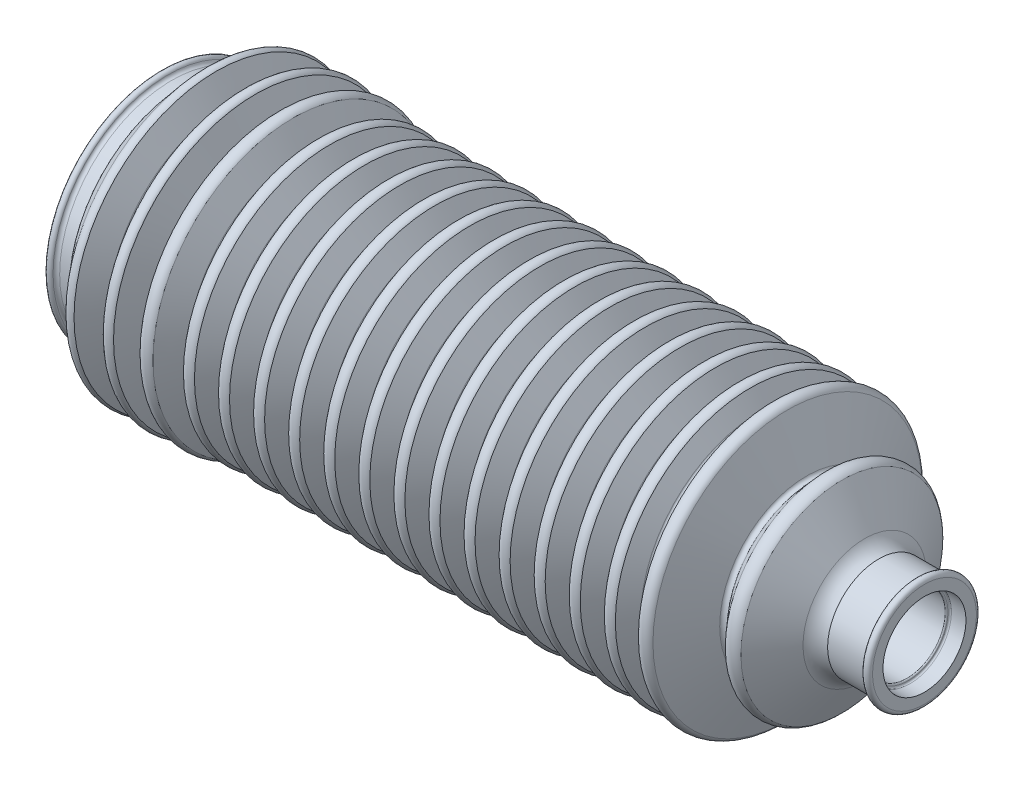
from build123d import *


with BuildPart() as part:
    # Çizim1 → Döndür1 (revolve)
    with BuildSketch(Plane.XY, mode=Mode.PRIVATE) as d_nd_r1_sk:
        with BuildLine():
            Line((2.442042698, 25.682705878), (5.35978701, 25.682705878))
            ThreePointArc((5.35978701, 25.682705878), (5.61428635, 25.959721917), (5.696851875, 26.32672428))
            ThreePointArc((5.696851875, 26.32672428), (5.767347383, 26.675489454), (5.996909977, 26.947349305))
            Line((5.996909977, 26.947349305), (10.710252465, 32.522734019))
            ThreePointArc((10.710252465, 32.522734019), (11.657912776, 32.930184403), (12.624912957, 32.571037453))
            Line((12.624912957, 32.571037453), (15.398221775, 27.429561456))
            ThreePointArc((15.398221775, 27.429561456), (16.049634164, 26.938765293), (16.73244835, 27.384841251))
            Line((16.73244835, 27.384841251), (19.206132076, 32.441141892))
            ThreePointArc((19.206132076, 32.441141892), (20.376636823, 33.053893473), (21.559377863, 32.465107017))
            Line((21.559377863, 32.465107017), (23.85452719, 27.056085174))
            ThreePointArc((23.85452719, 27.056085174), (24.292703712, 26.619455169), (24.811438207, 26.956440258))
            Line((24.811438207, 26.956440258), (27.308879439, 32.14423882))
            ThreePointArc((27.308879439, 32.14423882), (28.766548923, 32.766887292), (30.189293521, 32.068110321))
            Line((30.189293521, 32.068110321), (32.918133018, 26.850423285))
            ThreePointArc((32.918133018, 26.850423285), (33.296230534, 26.56762954), (33.711643836, 26.792043936))
            Line((33.711643836, 26.792043936), (35.858345326, 30.708160913))
            ThreePointArc((35.858345326, 30.708160913), (37.15712317, 31.493093553), (38.577391933, 30.958509809))
            Line((38.577391933, 30.958509809), (40.947829736, 26.850423285))
            ThreePointArc((40.947829736, 26.850423285), (41.325927251, 26.56762954), (41.741340554, 26.792043936))
            Line((41.741340554, 26.792043936), (43.888042043, 30.708160913))
            ThreePointArc((43.888042043, 30.708160913), (45.186819888, 31.493093553), (46.607088651, 30.958509809))
            Line((46.607088651, 30.958509809), (48.977526453, 26.850423285))
            ThreePointArc((48.977526453, 26.850423285), (49.355623969, 26.56762954), (49.771037271, 26.792043936))
            Line((49.771037271, 26.792043936), (51.917738761, 30.708160913))
            ThreePointArc((51.917738761, 30.708160913), (53.216516605, 31.493093553), (54.636785368, 30.958509809))
            Line((54.636785368, 30.958509809), (57.007223171, 26.850423285))
            ThreePointArc((57.007223171, 26.850423285), (57.385320686, 26.56762954), (57.800733989, 26.792043936))
            Line((57.800733989, 26.792043936), (59.947435478, 30.708160913))
            ThreePointArc((59.947435478, 30.708160913), (61.246213323, 31.493093553), (62.666482086, 30.958509809))
            Line((62.666482086, 30.958509809), (65.036919888, 26.850423285))
            ThreePointArc((65.036919888, 26.850423285), (65.415017404, 26.56762954), (65.830430706, 26.792043936))
            Line((65.830430706, 26.792043936), (67.977132196, 30.708160913))
            ThreePointArc((67.977132196, 30.708160913), (69.27591004, 31.493093553), (70.696178804, 30.958509809))
            Line((70.696178804, 30.958509809), (73.066616606, 26.850423285))
            ThreePointArc((73.066616606, 26.850423285), (73.444714121, 26.56762954), (73.860127424, 26.792043936))
            Line((73.860127424, 26.792043936), (76.006828913, 30.708160913))
            ThreePointArc((76.006828913, 30.708160913), (77.305606758, 31.493093553), (78.725875521, 30.958509809))
            Line((78.725875521, 30.958509809), (81.096313324, 26.850423285))
            ThreePointArc((81.096313324, 26.850423285), (81.474410839, 26.56762954), (81.889824141, 26.792043936))
            Line((81.889824141, 26.792043936), (84.036525631, 30.708160913))
            ThreePointArc((84.036525631, 30.708160913), (85.335303476, 31.493093553), (86.755572239, 30.958509809))
            Line((86.755572239, 30.958509809), (89.126010041, 26.850423285))
            ThreePointArc((89.126010041, 26.850423285), (89.504107557, 26.56762954), (89.919520859, 26.792043936))
            Line((89.919520859, 26.792043936), (92.066222349, 30.708160913))
            ThreePointArc((92.066222349, 30.708160913), (93.365000193, 31.493093553), (94.785268956, 30.958509809))
            Line((94.785268956, 30.958509809), (97.155706759, 26.850423285))
            ThreePointArc((97.155706759, 26.850423285), (97.533804274, 26.56762954), (97.949217576, 26.792043936))
            Line((97.949217576, 26.792043936), (100.095919066, 30.708160913))
            ThreePointArc((100.095919066, 30.708160913), (101.394696911, 31.493093553), (102.814965674, 30.958509809))
            Line((102.814965674, 30.958509809), (105.185403476, 26.850423285))
            ThreePointArc((105.185403476, 26.850423285), (105.563500992, 26.56762954), (105.978914294, 26.792043936))
            Line((105.978914294, 26.792043936), (108.125615784, 30.708160913))
            ThreePointArc((108.125615784, 30.708160913), (109.424393628, 31.493093553), (110.844662391, 30.958509809))
            Line((110.844662391, 30.958509809), (113.215100194, 26.850423285))
            ThreePointArc((113.215100194, 26.850423285), (113.593197709, 26.56762954), (114.008611012, 26.792043936))
            Line((114.008611012, 26.792043936), (116.155312501, 30.708160913))
            ThreePointArc((116.155312501, 30.708160913), (117.454090346, 31.493093553), (118.874359109, 30.958509809))
            Line((118.874359109, 30.958509809), (121.244796911, 26.850423285))
            ThreePointArc((121.244796911, 26.850423285), (121.622894427, 26.56762954), (122.038307729, 26.792043936))
            Line((122.038307729, 26.792043936), (124.185009219, 30.708160913))
            ThreePointArc((124.185009219, 30.708160913), (125.483787063, 31.493093553), (126.904055826, 30.958509809))
            Line((126.904055826, 30.958509809), (129.274493629, 26.850423285))
            ThreePointArc((129.274493629, 26.850423285), (129.652591144, 26.56762954), (130.068004447, 26.792043936))
            Line((130.068004447, 26.792043936), (132.214705936, 30.708160913))
            ThreePointArc((132.214705936, 30.708160913), (133.513483781, 31.493093553), (134.933752544, 30.958509809))
            Line((134.933752544, 30.958509809), (137.003102678, 27.231199731))
            ThreePointArc((137.003102678, 27.231199731), (137.522353031, 26.792745686), (138.095027457, 27.158678577))
            Line((138.095027457, 27.158678577), (140.4474933, 31.198150005))
            ThreePointArc((140.4474933, 31.198150005), (142.019308645, 31.747561139), (143.38797466, 30.799294608))
            Line((143.38797466, 30.799294608), (147.756696056, 19.89130372))
            ThreePointArc((147.756696056, 19.89130372), (148.478492271, 19.325581266), (149.293260388, 19.746514261))
            Line((149.293260388, 19.746514261), (152.570897164, 23.422760657))
            ThreePointArc((152.570897164, 23.422760657), (154.265532643, 23.899676013), (155.838603554, 23.109305484))
            Line((155.838603554, 23.109305484), (161.056752801, 14.122530471))
            ThreePointArc((161.056752801, 14.122530471), (162.409693933, 12.580908141), (164.252673676, 11.680644413))
            Line((164.252673676, 11.680644413), (172.770427911, 11.680644413))
            Line((172.770427911, 11.680644413), (173.175299598, 12.522344697))
            ThreePointArc((173.175299598, 12.522344697), (174.179585106, 12.744035966), (174.745412136, 11.885213415))
            Line((174.745412136, 11.885213415), (174.745412136, 9.495471636))
            Line((174.745412136, 9.495471636), (171.412261756, 9.495471636))
            ThreePointArc((171.412261756, 9.495471636), (171.134575872, 9.371222686), (171.03118499, 9.085115053))
            ThreePointArc((171.03118499, 9.085115053), (170.966821966, 8.846989429), (170.756640389, 8.717876624))
            Line((170.756640389, 8.717876624), (159.049586299, 8.717876624))
            ThreePointArc((159.049586299, 8.717876624), (158.40246844, 9.152762072), (158.366028349, 9.931581047))
            ThreePointArc((158.366028349, 9.931581047), (158.546163717, 10.518617261), (158.388132242, 11.111985882))
            Line((158.388132242, 11.111985882), (154.571799231, 20.966099368))
            ThreePointArc((154.571799231, 20.966099368), (153.983181793, 21.527538085), (153.205199925, 21.289992019))
            Line((153.205199925, 21.289992019), (150.837273255, 17.982691094))
            ThreePointArc((150.837273255, 17.982691094), (148.927617218, 16.948031449), (146.911647806, 17.756223312))
            Line((146.911647806, 17.756223312), (142.052871885, 28.853643127))
            ThreePointArc((142.052871885, 28.853643127), (141.595087994, 29.186041394), (141.130385982, 28.863385634))
            Line((141.130385982, 28.863385634), (139.458570702, 25.533688839))
            ThreePointArc((139.458570702, 25.533688839), (137.828021595, 24.471056274), (136.045067616, 25.251410981))
            Line((136.045067616, 25.251410981), (134.225962455, 29.183148344))
            ThreePointArc((134.225962455, 29.183148344), (133.718464326, 29.490471744), (133.239957896, 29.139710259))
            Line((133.239957896, 29.139710259), (131.138044211, 25.193455164))
            ThreePointArc((131.138044211, 25.193455164), (129.706550589, 24.471056274), (128.238236354, 25.115329085))
            Line((128.238236354, 25.115329085), (126.196265738, 29.183148344))
            ThreePointArc((126.196265738, 29.183148344), (125.688767609, 29.490471744), (125.210261179, 29.139710259))
            Line((125.210261179, 29.139710259), (123.108347493, 25.193455164))
            ThreePointArc((123.108347493, 25.193455164), (121.676853871, 24.471056274), (120.208539636, 25.115329085))
            Line((120.208539636, 25.115329085), (118.16656902, 29.183148344))
            ThreePointArc((118.16656902, 29.183148344), (117.659070891, 29.490471744), (117.180564461, 29.139710259))
            Line((117.180564461, 29.139710259), (115.078650775, 25.193455164))
            ThreePointArc((115.078650775, 25.193455164), (113.647157153, 24.471056274), (112.178842919, 25.115329085))
            Line((112.178842919, 25.115329085), (110.136872303, 29.183148344))
            ThreePointArc((110.136872303, 29.183148344), (109.629374174, 29.490471744), (109.150867744, 29.139710259))
            Line((109.150867744, 29.139710259), (107.048954058, 25.193455164))
            ThreePointArc((107.048954058, 25.193455164), (105.617460436, 24.471056274), (104.149146201, 25.115329085))
            Line((104.149146201, 25.115329085), (102.107175585, 29.183148344))
            ThreePointArc((102.107175585, 29.183148344), (101.599677456, 29.490471744), (101.121171026, 29.139710259))
            Line((101.121171026, 29.139710259), (99.01925734, 25.193455164))
            ThreePointArc((99.01925734, 25.193455164), (97.587763718, 24.471056274), (96.119449484, 25.115329085))
            Line((96.119449484, 25.115329085), (94.077478868, 29.183148344))
            ThreePointArc((94.077478868, 29.183148344), (93.569980739, 29.490471744), (93.091474308, 29.139710259))
            Line((93.091474308, 29.139710259), (90.989560623, 25.193455164))
            ThreePointArc((90.989560623, 25.193455164), (89.558067001, 24.471056274), (88.089752766, 25.115329085))
            Line((88.089752766, 25.115329085), (86.04778215, 29.183148344))
            ThreePointArc((86.04778215, 29.183148344), (85.540284021, 29.490471744), (85.061777591, 29.139710259))
            Line((85.061777591, 29.139710259), (82.959863905, 25.193455164))
            ThreePointArc((82.959863905, 25.193455164), (81.528370283, 24.471056274), (80.060056049, 25.115329085))
            Line((80.060056049, 25.115329085), (78.018085432, 29.183148344))
            ThreePointArc((78.018085432, 29.183148344), (77.510587303, 29.490471744), (77.032080873, 29.139710259))
            Line((77.032080873, 29.139710259), (74.930167188, 25.193455164))
            ThreePointArc((74.930167188, 25.193455164), (73.498673566, 24.471056274), (72.030359331, 25.115329085))
            Line((72.030359331, 25.115329085), (69.988388715, 29.183148344))
            ThreePointArc((69.988388715, 29.183148344), (69.480890586, 29.490471744), (69.002384156, 29.139710259))
            Line((69.002384156, 29.139710259), (66.90047047, 25.193455164))
            ThreePointArc((66.90047047, 25.193455164), (65.468976848, 24.471056274), (64.000662613, 25.115329085))
            Line((64.000662613, 25.115329085), (61.958691997, 29.183148344))
            ThreePointArc((61.958691997, 29.183148344), (61.451193868, 29.490471744), (60.972687438, 29.139710259))
            Line((60.972687438, 29.139710259), (58.870773752, 25.193455164))
            ThreePointArc((58.870773752, 25.193455164), (57.439280131, 24.471056274), (55.970965896, 25.115329085))
            Line((55.970965896, 25.115329085), (53.92899528, 29.183148344))
            ThreePointArc((53.92899528, 29.183148344), (53.421497151, 29.490471744), (52.942990721, 29.139710259))
            Line((52.942990721, 29.139710259), (50.841077035, 25.193455164))
            ThreePointArc((50.841077035, 25.193455164), (49.409583413, 24.471056274), (47.941269178, 25.115329085))
            Line((47.941269178, 25.115329085), (45.899298562, 29.183148344))
            ThreePointArc((45.899298562, 29.183148344), (45.391800433, 29.490471744), (44.913294003, 29.139710259))
            Line((44.913294003, 29.139710259), (42.811380317, 25.193455164))
            ThreePointArc((42.811380317, 25.193455164), (41.379886695, 24.471056274), (39.911572461, 25.115329085))
            Line((39.911572461, 25.115329085), (37.869601845, 29.183148344))
            ThreePointArc((37.869601845, 29.183148344), (37.362103716, 29.490471744), (36.883597286, 29.139710259))
            Line((36.883597286, 29.139710259), (34.7816836, 25.193455164))
            ThreePointArc((34.7816836, 25.193455164), (33.350189978, 24.471056274), (31.881875743, 25.115329085))
            Line((31.881875743, 25.115329085), (29.232591279, 30.44177292))
            ThreePointArc((29.232591279, 30.44177292), (28.842394323, 30.797650926), (28.383153801, 30.536880985))
            Line((28.383153801, 30.536880985), (26.021883109, 25.287925069))
            ThreePointArc((26.021883109, 25.287925069), (24.535586555, 24.41371875), (23.011079578, 25.219443647))
            Line((23.011079578, 25.219443647), (20.715948343, 30.678444379))
            ThreePointArc((20.715948343, 30.678444379), (20.251245055, 30.975384363), (19.798547996, 30.660443302))
            Line((19.798547996, 30.660443302), (17.840281527, 25.81157748))
            ThreePointArc((17.840281527, 25.81157748), (16.599618096, 24.579581834), (14.918417673, 25.059815274))
            Line((14.918417673, 25.059815274), (11.735194389, 30.71265879))
            ThreePointArc((11.735194389, 30.71265879), (11.367878231, 30.960207215), (11.007549587, 30.702593841))
            Line((11.007549587, 30.702593841), (7.452211974, 23.888842144))
            ThreePointArc((7.452211974, 23.888842144), (7.226806273, 23.392174295), (7.159197756, 22.85095736))
            ThreePointArc((7.159197756, 22.85095736), (7.127195248, 22.135041288), (6.611121744, 21.637820893))
            Line((6.611121744, 21.637820893), (0.754919183, 21.637820893))
            ThreePointArc((0.754919183, 21.637820893), (0.252237781, 21.803771832), (0, 22.269179617))
            Line((0, 22.269179617), (0, 25.933770663))
            ThreePointArc((0, 25.933770663), (0.609216599, 26.805406278), (1.54107392, 26.293024154))
            ThreePointArc((1.54107392, 26.293024154), (1.877827338, 25.8199722), (2.442042698, 25.682705878))
        make_face()
    revolve(d_nd_r1_sk.sketch.rotate(Axis((0, 0, 0), (1, 0, 0)), 90), axis=Axis((0, 0, 0), (1, 0, 0)))


solid = part.part
